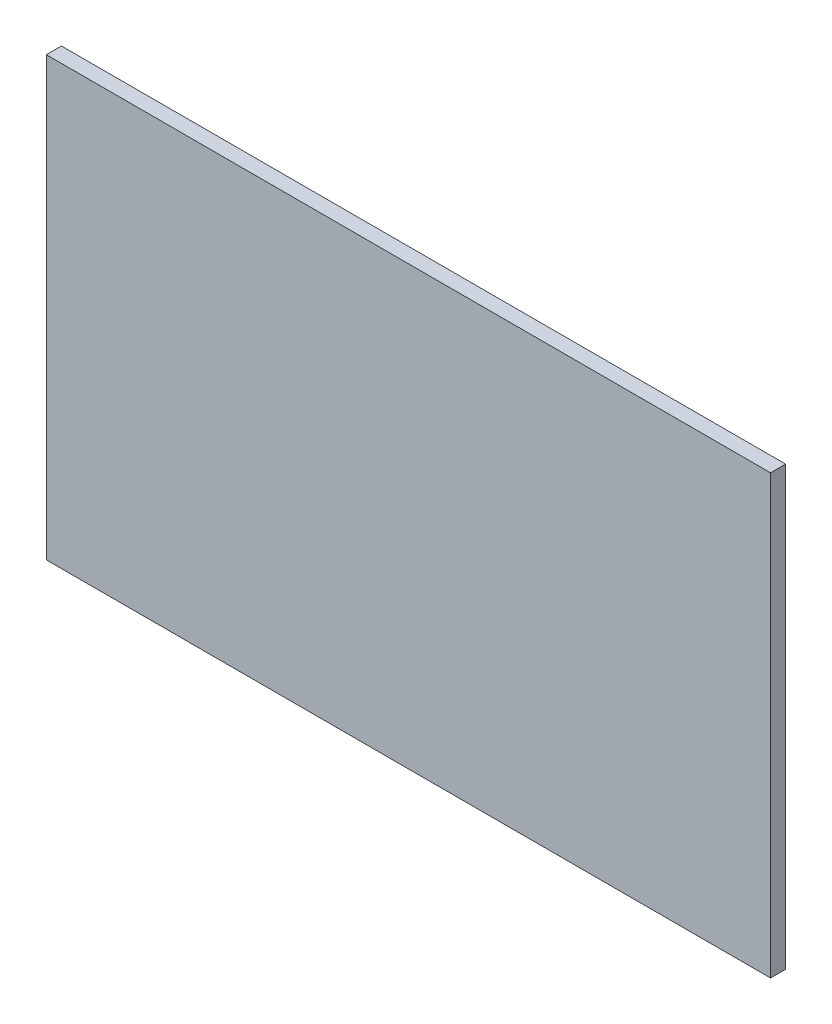
from build123d import *

# Parameters (mm, degrees)
ESQUISSE1_W        = 240
ESQUISSE1_H        = 145
BOSS_EXTRU_1_DEPTH = 5


with BuildPart() as part:
    # Esquisse1 → Boss.-Extru.1 (new body)
    with BuildSketch(Plane.XY):
        with Locations((120, -72.5)):
            Rectangle(ESQUISSE1_W, ESQUISSE1_H)
    extrude(amount=BOSS_EXTRU_1_DEPTH)


solid = part.part
